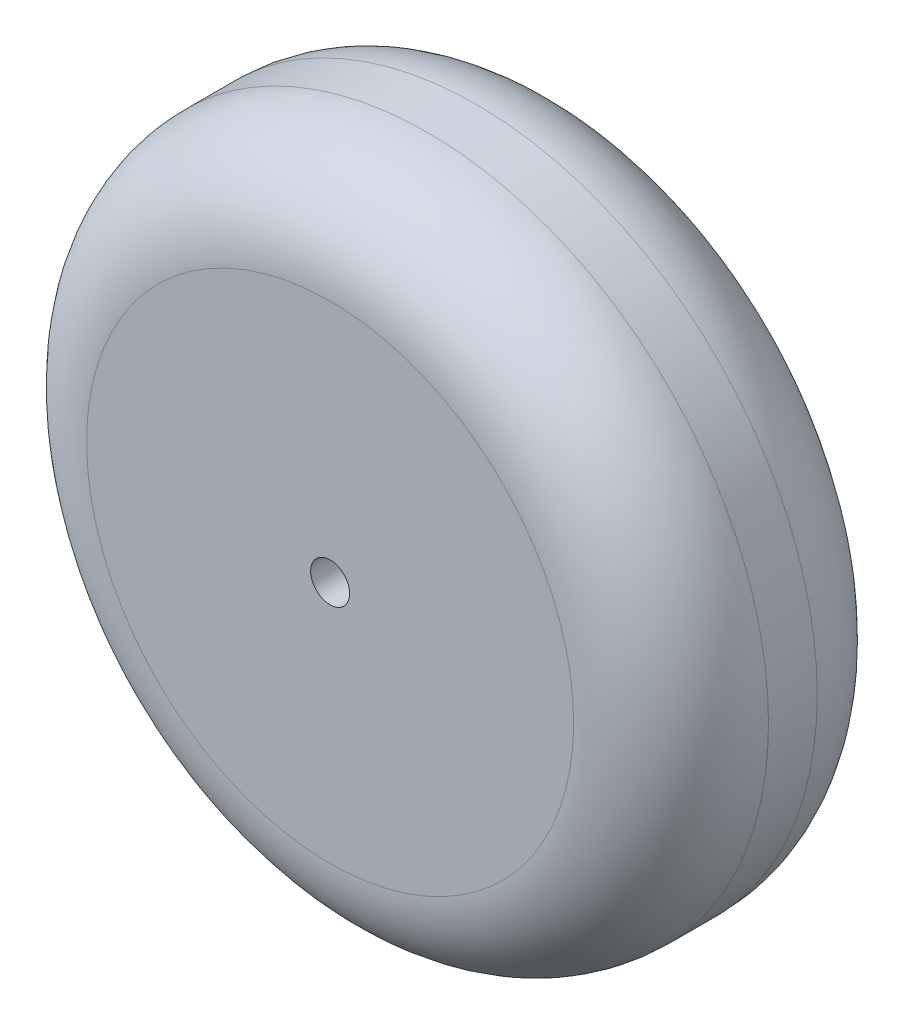
from build123d import *

# Parameters (mm, degrees)
IZIM1_R                     = 35
Y_KSEKLIK_EKSTR_ZYON1_DEPTH = 25
IZIM2_R                     = 2
KES_EKSTR_ZYON1_DEPTH       = 9
RADYUS1_R                   = 10
RADYUS2_R                   = 10


with BuildPart() as part:
    # Çizim1 → Yükseklik-Ekstrüzyon1 (new body)
    with BuildSketch(Plane.XY):
        Circle(IZIM1_R)
    extrude(amount=Y_KSEKLIK_EKSTR_ZYON1_DEPTH)

    # Çizim2 → Kes-Ekstrüzyon1 (cut)
    with BuildSketch(Plane.XY.offset(25)):
        Circle(IZIM2_R)
    extrude(amount=-KES_EKSTR_ZYON1_DEPTH, mode=Mode.SUBTRACT)

    # Radyus1
    radyus1_edges = [part.edges().sort_by_distance(p)[0] for p in [
        (-35, 0, 0),
    ]]
    fillet(radyus1_edges, radius=RADYUS1_R)

    # Radyus2
    radyus2_edges = [part.edges().sort_by_distance(p)[0] for p in [
        (-35, 0, 25),
    ]]
    fillet(radyus2_edges, radius=RADYUS2_R)


solid = part.part
